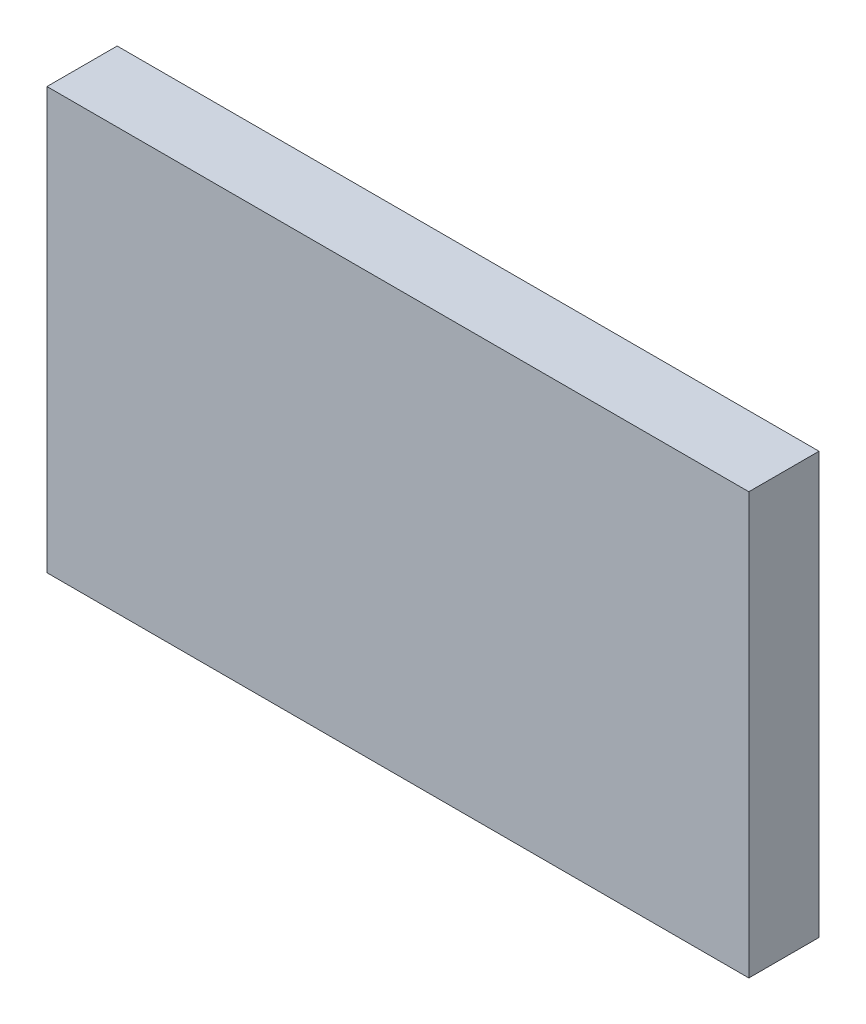
from build123d import *

# Parameters (mm, degrees)
SKETCH_8_W      = 100
SKETCH_8_H      = 60
EXTRUDE_1_DEPTH = 10


with BuildPart() as part:
    # 草图8 → 凸台-拉伸1 (new body)
    with BuildSketch(Plane.XY):
        Rectangle(SKETCH_8_W, SKETCH_8_H)
    extrude(amount=EXTRUDE_1_DEPTH)


solid = part.part
